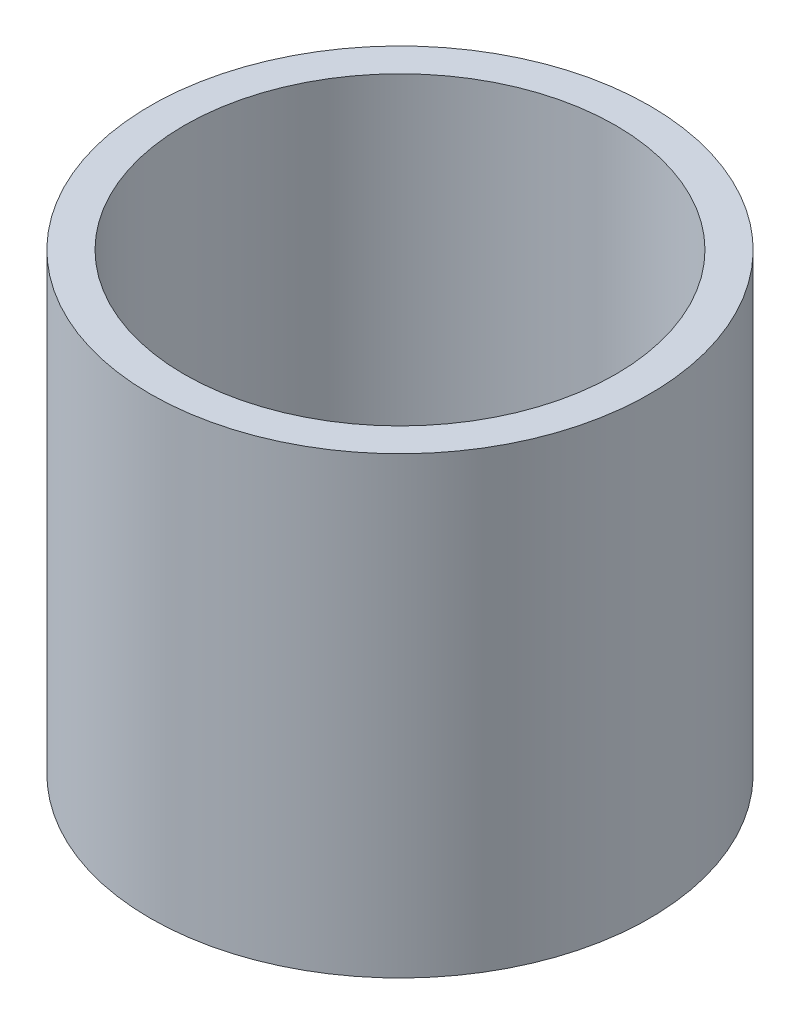
from build123d import *

# Parameters (mm, degrees)
SKETCH1_R           = 22
SKETCH1_R_2         = 19
BOSS_EXTRUDE1_DEPTH = 40


with BuildPart() as part:
    # Sketch1 → Boss-Extrude1 (new body)
    with BuildSketch(Plane(origin=(0, 0, 0), x_dir=(1, 0, 0), z_dir=(0, 1, 0))):
        with Locations(Location((0, 0, 0), (0, 0, 270))):
            Circle(SKETCH1_R)
        with Locations(Location((0, 0, 0), (0, 0, 270))):
            Circle(SKETCH1_R_2, mode=Mode.SUBTRACT)
    extrude(amount=BOSS_EXTRUDE1_DEPTH)


solid = part.part
